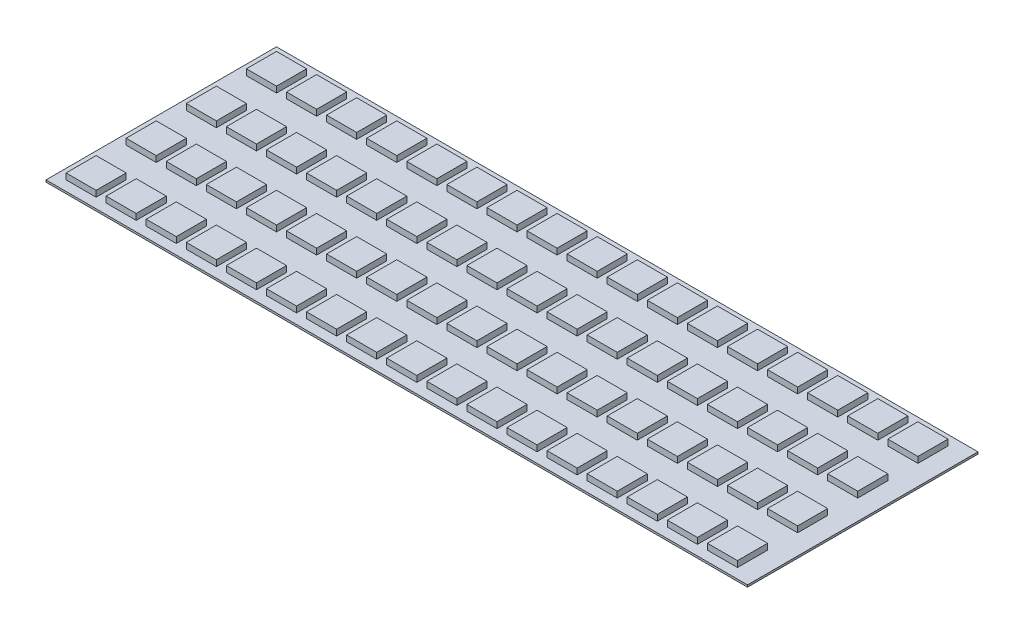
from build123d import *

# Parameters (mm, degrees)
SKETCH_1_W                        = 350
SKETCH_1_H                        = 115
EXTRUDE_1_DEPTH                   = 1
SKETCH_2_W                        = 15
SKETCH_2_H                        = 15
EXTRUDE_2_DEPTH                   = 3
PATTERN_LINEAR_1_COUNT            = 17
PATTERN_LINEAR_1_PITCH            = 20
PATTERN_LINEAR_2_COUNT            = 4
PATTERN_LINEAR_2_PITCH            = 30
PATTERN_LINEAR_2_COPY_1_SKETCH_W  = 15
PATTERN_LINEAR_2_COPY_1_SKETCH_H  = 15
PATTERN_LINEAR_2_COPY_1_DEPTH     = 3
PATTERN_LINEAR_2_COPY_2_SKETCH_W  = 15
PATTERN_LINEAR_2_COPY_2_SKETCH_H  = 15
PATTERN_LINEAR_2_COPY_2_DEPTH     = 3
PATTERN_LINEAR_2_COPY_3_SKETCH_W  = 15
PATTERN_LINEAR_2_COPY_3_SKETCH_H  = 15
PATTERN_LINEAR_2_COPY_3_DEPTH     = 3
PATTERN_LINEAR_2_COPY_4_SKETCH_W  = 15
PATTERN_LINEAR_2_COPY_4_SKETCH_H  = 15
PATTERN_LINEAR_2_COPY_4_DEPTH     = 3
PATTERN_LINEAR_2_COPY_5_SKETCH_W  = 15
PATTERN_LINEAR_2_COPY_5_SKETCH_H  = 15
PATTERN_LINEAR_2_COPY_5_DEPTH     = 3
PATTERN_LINEAR_2_COPY_6_SKETCH_W  = 15
PATTERN_LINEAR_2_COPY_6_SKETCH_H  = 15
PATTERN_LINEAR_2_COPY_6_DEPTH     = 3
PATTERN_LINEAR_2_COPY_7_SKETCH_W  = 15
PATTERN_LINEAR_2_COPY_7_SKETCH_H  = 15
PATTERN_LINEAR_2_COPY_7_DEPTH     = 3
PATTERN_LINEAR_2_COPY_8_SKETCH_W  = 15
PATTERN_LINEAR_2_COPY_8_SKETCH_H  = 15
PATTERN_LINEAR_2_COPY_8_DEPTH     = 3
PATTERN_LINEAR_2_COPY_9_SKETCH_W  = 15
PATTERN_LINEAR_2_COPY_9_SKETCH_H  = 15
PATTERN_LINEAR_2_COPY_9_DEPTH     = 3
PATTERN_LINEAR_2_COPY_10_SKETCH_W = 15
PATTERN_LINEAR_2_COPY_10_SKETCH_H = 15
PATTERN_LINEAR_2_COPY_10_DEPTH    = 3
PATTERN_LINEAR_2_COPY_11_SKETCH_W = 15
PATTERN_LINEAR_2_COPY_11_SKETCH_H = 15
PATTERN_LINEAR_2_COPY_11_DEPTH    = 3
PATTERN_LINEAR_2_COPY_12_SKETCH_W = 15
PATTERN_LINEAR_2_COPY_12_SKETCH_H = 15
PATTERN_LINEAR_2_COPY_12_DEPTH    = 3
PATTERN_LINEAR_2_COPY_13_SKETCH_W = 15
PATTERN_LINEAR_2_COPY_13_SKETCH_H = 15
PATTERN_LINEAR_2_COPY_13_DEPTH    = 3
PATTERN_LINEAR_2_COPY_14_SKETCH_W = 15
PATTERN_LINEAR_2_COPY_14_SKETCH_H = 15
PATTERN_LINEAR_2_COPY_14_DEPTH    = 3
PATTERN_LINEAR_2_COPY_15_SKETCH_W = 15
PATTERN_LINEAR_2_COPY_15_SKETCH_H = 15
PATTERN_LINEAR_2_COPY_15_DEPTH    = 3
PATTERN_LINEAR_2_COPY_16_SKETCH_W = 15
PATTERN_LINEAR_2_COPY_16_SKETCH_H = 15
PATTERN_LINEAR_2_COPY_16_DEPTH    = 3
PATTERN_LINEAR_2_COPY_17_SKETCH_W = 15
PATTERN_LINEAR_2_COPY_17_SKETCH_H = 15
PATTERN_LINEAR_2_COPY_17_DEPTH    = 3
PATTERN_LINEAR_2_COPY_18_SKETCH_W = 15
PATTERN_LINEAR_2_COPY_18_SKETCH_H = 15
PATTERN_LINEAR_2_COPY_18_DEPTH    = 3
PATTERN_LINEAR_2_COPY_19_SKETCH_W = 15
PATTERN_LINEAR_2_COPY_19_SKETCH_H = 15
PATTERN_LINEAR_2_COPY_19_DEPTH    = 3
PATTERN_LINEAR_2_COPY_20_SKETCH_W = 15
PATTERN_LINEAR_2_COPY_20_SKETCH_H = 15
PATTERN_LINEAR_2_COPY_20_DEPTH    = 3
PATTERN_LINEAR_2_COPY_21_SKETCH_W = 15
PATTERN_LINEAR_2_COPY_21_SKETCH_H = 15
PATTERN_LINEAR_2_COPY_21_DEPTH    = 3
PATTERN_LINEAR_2_COPY_22_SKETCH_W = 15
PATTERN_LINEAR_2_COPY_22_SKETCH_H = 15
PATTERN_LINEAR_2_COPY_22_DEPTH    = 3
PATTERN_LINEAR_2_COPY_23_SKETCH_W = 15
PATTERN_LINEAR_2_COPY_23_SKETCH_H = 15
PATTERN_LINEAR_2_COPY_23_DEPTH    = 3
PATTERN_LINEAR_2_COPY_24_SKETCH_W = 15
PATTERN_LINEAR_2_COPY_24_SKETCH_H = 15
PATTERN_LINEAR_2_COPY_24_DEPTH    = 3
PATTERN_LINEAR_2_COPY_25_SKETCH_W = 15
PATTERN_LINEAR_2_COPY_25_SKETCH_H = 15
PATTERN_LINEAR_2_COPY_25_DEPTH    = 3
PATTERN_LINEAR_2_COPY_26_SKETCH_W = 15
PATTERN_LINEAR_2_COPY_26_SKETCH_H = 15
PATTERN_LINEAR_2_COPY_26_DEPTH    = 3
PATTERN_LINEAR_2_COPY_27_SKETCH_W = 15
PATTERN_LINEAR_2_COPY_27_SKETCH_H = 15
PATTERN_LINEAR_2_COPY_27_DEPTH    = 3
PATTERN_LINEAR_2_COPY_28_SKETCH_W = 15
PATTERN_LINEAR_2_COPY_28_SKETCH_H = 15
PATTERN_LINEAR_2_COPY_28_DEPTH    = 3
PATTERN_LINEAR_2_COPY_29_SKETCH_W = 15
PATTERN_LINEAR_2_COPY_29_SKETCH_H = 15
PATTERN_LINEAR_2_COPY_29_DEPTH    = 3
PATTERN_LINEAR_2_COPY_30_SKETCH_W = 15
PATTERN_LINEAR_2_COPY_30_SKETCH_H = 15
PATTERN_LINEAR_2_COPY_30_DEPTH    = 3
PATTERN_LINEAR_2_COPY_31_SKETCH_W = 15
PATTERN_LINEAR_2_COPY_31_SKETCH_H = 15
PATTERN_LINEAR_2_COPY_31_DEPTH    = 3
PATTERN_LINEAR_2_COPY_32_SKETCH_W = 15
PATTERN_LINEAR_2_COPY_32_SKETCH_H = 15
PATTERN_LINEAR_2_COPY_32_DEPTH    = 3
PATTERN_LINEAR_2_COPY_33_SKETCH_W = 15
PATTERN_LINEAR_2_COPY_33_SKETCH_H = 15
PATTERN_LINEAR_2_COPY_33_DEPTH    = 3
PATTERN_LINEAR_2_COPY_34_SKETCH_W = 15
PATTERN_LINEAR_2_COPY_34_SKETCH_H = 15
PATTERN_LINEAR_2_COPY_34_DEPTH    = 3
PATTERN_LINEAR_2_COPY_35_SKETCH_W = 15
PATTERN_LINEAR_2_COPY_35_SKETCH_H = 15
PATTERN_LINEAR_2_COPY_35_DEPTH    = 3
PATTERN_LINEAR_2_COPY_36_SKETCH_W = 15
PATTERN_LINEAR_2_COPY_36_SKETCH_H = 15
PATTERN_LINEAR_2_COPY_36_DEPTH    = 3
PATTERN_LINEAR_2_COPY_37_SKETCH_W = 15
PATTERN_LINEAR_2_COPY_37_SKETCH_H = 15
PATTERN_LINEAR_2_COPY_37_DEPTH    = 3
PATTERN_LINEAR_2_COPY_38_SKETCH_W = 15
PATTERN_LINEAR_2_COPY_38_SKETCH_H = 15
PATTERN_LINEAR_2_COPY_38_DEPTH    = 3
PATTERN_LINEAR_2_COPY_39_SKETCH_W = 15
PATTERN_LINEAR_2_COPY_39_SKETCH_H = 15
PATTERN_LINEAR_2_COPY_39_DEPTH    = 3
PATTERN_LINEAR_2_COPY_40_SKETCH_W = 15
PATTERN_LINEAR_2_COPY_40_SKETCH_H = 15
PATTERN_LINEAR_2_COPY_40_DEPTH    = 3
PATTERN_LINEAR_2_COPY_41_SKETCH_W = 15
PATTERN_LINEAR_2_COPY_41_SKETCH_H = 15
PATTERN_LINEAR_2_COPY_41_DEPTH    = 3
PATTERN_LINEAR_2_COPY_42_SKETCH_W = 15
PATTERN_LINEAR_2_COPY_42_SKETCH_H = 15
PATTERN_LINEAR_2_COPY_42_DEPTH    = 3
PATTERN_LINEAR_2_COPY_43_SKETCH_W = 15
PATTERN_LINEAR_2_COPY_43_SKETCH_H = 15
PATTERN_LINEAR_2_COPY_43_DEPTH    = 3
PATTERN_LINEAR_2_COPY_44_SKETCH_W = 15
PATTERN_LINEAR_2_COPY_44_SKETCH_H = 15
PATTERN_LINEAR_2_COPY_44_DEPTH    = 3
PATTERN_LINEAR_2_COPY_45_SKETCH_W = 15
PATTERN_LINEAR_2_COPY_45_SKETCH_H = 15
PATTERN_LINEAR_2_COPY_45_DEPTH    = 3
PATTERN_LINEAR_2_COPY_46_SKETCH_W = 15
PATTERN_LINEAR_2_COPY_46_SKETCH_H = 15
PATTERN_LINEAR_2_COPY_46_DEPTH    = 3
PATTERN_LINEAR_2_COPY_47_SKETCH_W = 15
PATTERN_LINEAR_2_COPY_47_SKETCH_H = 15
PATTERN_LINEAR_2_COPY_47_DEPTH    = 3
PATTERN_LINEAR_2_COPY_48_SKETCH_W = 15
PATTERN_LINEAR_2_COPY_48_SKETCH_H = 15
PATTERN_LINEAR_2_COPY_48_DEPTH    = 3


with BuildPart() as part:
    # 草圖1 → 填料-伸長1 (new body)
    with BuildSketch(Plane(origin=(0, 0, 0), x_dir=(1, 0, 0), z_dir=(0, 1, 0))):
        with Locations((175, 57.5)):
            Rectangle(SKETCH_1_W, SKETCH_1_H)
    extrude(amount=EXTRUDE_1_DEPTH)

    # 草圖2 → 填料-伸長2 (add)
    with BuildSketch(Plane(origin=(0, 1, 0), x_dir=(1, 0, 0), z_dir=(0, 1, 0))):
        with Locations((12.5, 12.5)):
            Rectangle(SKETCH_2_W, SKETCH_2_H)
    extrude_2 = extrude(amount=EXTRUDE_2_DEPTH)

    # 直線複製排列1: 填料-伸長2 ×17
    with Locations(*[(i * PATTERN_LINEAR_1_PITCH, 0, 0) for i in range(1, PATTERN_LINEAR_1_COUNT)]):
        add(extrude_2)

    # 直線複製排列2: 填料-伸長2 ×4
    with Locations(*[(0, 0, -i * PATTERN_LINEAR_2_PITCH) for i in range(1, PATTERN_LINEAR_2_COUNT)]):
        add(extrude_2)

    # 直線複製排列2 copy 1 sketch → 直線複製排列2 copy 1 (add)
    with BuildSketch(Plane(origin=(20, 1, -30), x_dir=(1, 0, 0), z_dir=(0, 1, 0))):
        with Locations((12.5, 12.5)):
            Rectangle(PATTERN_LINEAR_2_COPY_1_SKETCH_W, PATTERN_LINEAR_2_COPY_1_SKETCH_H)
    extrude(amount=PATTERN_LINEAR_2_COPY_1_DEPTH)

    # 直線複製排列2 copy 2 sketch → 直線複製排列2 copy 2 (add)
    with BuildSketch(Plane(origin=(20, 1, -60), x_dir=(1, 0, 0), z_dir=(0, 1, 0))):
        with Locations((12.5, 12.5)):
            Rectangle(PATTERN_LINEAR_2_COPY_2_SKETCH_W, PATTERN_LINEAR_2_COPY_2_SKETCH_H)
    extrude(amount=PATTERN_LINEAR_2_COPY_2_DEPTH)

    # 直線複製排列2 copy 3 sketch → 直線複製排列2 copy 3 (add)
    with BuildSketch(Plane(origin=(20, 1, -90), x_dir=(1, 0, 0), z_dir=(0, 1, 0))):
        with Locations((12.5, 12.5)):
            Rectangle(PATTERN_LINEAR_2_COPY_3_SKETCH_W, PATTERN_LINEAR_2_COPY_3_SKETCH_H)
    extrude(amount=PATTERN_LINEAR_2_COPY_3_DEPTH)

    # 直線複製排列2 copy 4 sketch → 直線複製排列2 copy 4 (add)
    with BuildSketch(Plane(origin=(40, 1, -30), x_dir=(1, 0, 0), z_dir=(0, 1, 0))):
        with Locations((12.5, 12.5)):
            Rectangle(PATTERN_LINEAR_2_COPY_4_SKETCH_W, PATTERN_LINEAR_2_COPY_4_SKETCH_H)
    extrude(amount=PATTERN_LINEAR_2_COPY_4_DEPTH)

    # 直線複製排列2 copy 5 sketch → 直線複製排列2 copy 5 (add)
    with BuildSketch(Plane(origin=(40, 1, -60), x_dir=(1, 0, 0), z_dir=(0, 1, 0))):
        with Locations((12.5, 12.5)):
            Rectangle(PATTERN_LINEAR_2_COPY_5_SKETCH_W, PATTERN_LINEAR_2_COPY_5_SKETCH_H)
    extrude(amount=PATTERN_LINEAR_2_COPY_5_DEPTH)

    # 直線複製排列2 copy 6 sketch → 直線複製排列2 copy 6 (add)
    with BuildSketch(Plane(origin=(40, 1, -90), x_dir=(1, 0, 0), z_dir=(0, 1, 0))):
        with Locations((12.5, 12.5)):
            Rectangle(PATTERN_LINEAR_2_COPY_6_SKETCH_W, PATTERN_LINEAR_2_COPY_6_SKETCH_H)
    extrude(amount=PATTERN_LINEAR_2_COPY_6_DEPTH)

    # 直線複製排列2 copy 7 sketch → 直線複製排列2 copy 7 (add)
    with BuildSketch(Plane(origin=(60, 1, -30), x_dir=(1, 0, 0), z_dir=(0, 1, 0))):
        with Locations((12.5, 12.5)):
            Rectangle(PATTERN_LINEAR_2_COPY_7_SKETCH_W, PATTERN_LINEAR_2_COPY_7_SKETCH_H)
    extrude(amount=PATTERN_LINEAR_2_COPY_7_DEPTH)

    # 直線複製排列2 copy 8 sketch → 直線複製排列2 copy 8 (add)
    with BuildSketch(Plane(origin=(60, 1, -60), x_dir=(1, 0, 0), z_dir=(0, 1, 0))):
        with Locations((12.5, 12.5)):
            Rectangle(PATTERN_LINEAR_2_COPY_8_SKETCH_W, PATTERN_LINEAR_2_COPY_8_SKETCH_H)
    extrude(amount=PATTERN_LINEAR_2_COPY_8_DEPTH)

    # 直線複製排列2 copy 9 sketch → 直線複製排列2 copy 9 (add)
    with BuildSketch(Plane(origin=(60, 1, -90), x_dir=(1, 0, 0), z_dir=(0, 1, 0))):
        with Locations((12.5, 12.5)):
            Rectangle(PATTERN_LINEAR_2_COPY_9_SKETCH_W, PATTERN_LINEAR_2_COPY_9_SKETCH_H)
    extrude(amount=PATTERN_LINEAR_2_COPY_9_DEPTH)

    # 直線複製排列2 copy 10 sketch → 直線複製排列2 copy 10 (add)
    with BuildSketch(Plane(origin=(80, 1, -30), x_dir=(1, 0, 0), z_dir=(0, 1, 0))):
        with Locations((12.5, 12.5)):
            Rectangle(PATTERN_LINEAR_2_COPY_10_SKETCH_W, PATTERN_LINEAR_2_COPY_10_SKETCH_H)
    extrude(amount=PATTERN_LINEAR_2_COPY_10_DEPTH)

    # 直線複製排列2 copy 11 sketch → 直線複製排列2 copy 11 (add)
    with BuildSketch(Plane(origin=(80, 1, -60), x_dir=(1, 0, 0), z_dir=(0, 1, 0))):
        with Locations((12.5, 12.5)):
            Rectangle(PATTERN_LINEAR_2_COPY_11_SKETCH_W, PATTERN_LINEAR_2_COPY_11_SKETCH_H)
    extrude(amount=PATTERN_LINEAR_2_COPY_11_DEPTH)

    # 直線複製排列2 copy 12 sketch → 直線複製排列2 copy 12 (add)
    with BuildSketch(Plane(origin=(80, 1, -90), x_dir=(1, 0, 0), z_dir=(0, 1, 0))):
        with Locations((12.5, 12.5)):
            Rectangle(PATTERN_LINEAR_2_COPY_12_SKETCH_W, PATTERN_LINEAR_2_COPY_12_SKETCH_H)
    extrude(amount=PATTERN_LINEAR_2_COPY_12_DEPTH)

    # 直線複製排列2 copy 13 sketch → 直線複製排列2 copy 13 (add)
    with BuildSketch(Plane(origin=(100, 1, -30), x_dir=(1, 0, 0), z_dir=(0, 1, 0))):
        with Locations((12.5, 12.5)):
            Rectangle(PATTERN_LINEAR_2_COPY_13_SKETCH_W, PATTERN_LINEAR_2_COPY_13_SKETCH_H)
    extrude(amount=PATTERN_LINEAR_2_COPY_13_DEPTH)

    # 直線複製排列2 copy 14 sketch → 直線複製排列2 copy 14 (add)
    with BuildSketch(Plane(origin=(100, 1, -60), x_dir=(1, 0, 0), z_dir=(0, 1, 0))):
        with Locations((12.5, 12.5)):
            Rectangle(PATTERN_LINEAR_2_COPY_14_SKETCH_W, PATTERN_LINEAR_2_COPY_14_SKETCH_H)
    extrude(amount=PATTERN_LINEAR_2_COPY_14_DEPTH)

    # 直線複製排列2 copy 15 sketch → 直線複製排列2 copy 15 (add)
    with BuildSketch(Plane(origin=(100, 1, -90), x_dir=(1, 0, 0), z_dir=(0, 1, 0))):
        with Locations((12.5, 12.5)):
            Rectangle(PATTERN_LINEAR_2_COPY_15_SKETCH_W, PATTERN_LINEAR_2_COPY_15_SKETCH_H)
    extrude(amount=PATTERN_LINEAR_2_COPY_15_DEPTH)

    # 直線複製排列2 copy 16 sketch → 直線複製排列2 copy 16 (add)
    with BuildSketch(Plane(origin=(120, 1, -30), x_dir=(1, 0, 0), z_dir=(0, 1, 0))):
        with Locations((12.5, 12.5)):
            Rectangle(PATTERN_LINEAR_2_COPY_16_SKETCH_W, PATTERN_LINEAR_2_COPY_16_SKETCH_H)
    extrude(amount=PATTERN_LINEAR_2_COPY_16_DEPTH)

    # 直線複製排列2 copy 17 sketch → 直線複製排列2 copy 17 (add)
    with BuildSketch(Plane(origin=(120, 1, -60), x_dir=(1, 0, 0), z_dir=(0, 1, 0))):
        with Locations((12.5, 12.5)):
            Rectangle(PATTERN_LINEAR_2_COPY_17_SKETCH_W, PATTERN_LINEAR_2_COPY_17_SKETCH_H)
    extrude(amount=PATTERN_LINEAR_2_COPY_17_DEPTH)

    # 直線複製排列2 copy 18 sketch → 直線複製排列2 copy 18 (add)
    with BuildSketch(Plane(origin=(120, 1, -90), x_dir=(1, 0, 0), z_dir=(0, 1, 0))):
        with Locations((12.5, 12.5)):
            Rectangle(PATTERN_LINEAR_2_COPY_18_SKETCH_W, PATTERN_LINEAR_2_COPY_18_SKETCH_H)
    extrude(amount=PATTERN_LINEAR_2_COPY_18_DEPTH)

    # 直線複製排列2 copy 19 sketch → 直線複製排列2 copy 19 (add)
    with BuildSketch(Plane(origin=(140, 1, -30), x_dir=(1, 0, 0), z_dir=(0, 1, 0))):
        with Locations((12.5, 12.5)):
            Rectangle(PATTERN_LINEAR_2_COPY_19_SKETCH_W, PATTERN_LINEAR_2_COPY_19_SKETCH_H)
    extrude(amount=PATTERN_LINEAR_2_COPY_19_DEPTH)

    # 直線複製排列2 copy 20 sketch → 直線複製排列2 copy 20 (add)
    with BuildSketch(Plane(origin=(140, 1, -60), x_dir=(1, 0, 0), z_dir=(0, 1, 0))):
        with Locations((12.5, 12.5)):
            Rectangle(PATTERN_LINEAR_2_COPY_20_SKETCH_W, PATTERN_LINEAR_2_COPY_20_SKETCH_H)
    extrude(amount=PATTERN_LINEAR_2_COPY_20_DEPTH)

    # 直線複製排列2 copy 21 sketch → 直線複製排列2 copy 21 (add)
    with BuildSketch(Plane(origin=(140, 1, -90), x_dir=(1, 0, 0), z_dir=(0, 1, 0))):
        with Locations((12.5, 12.5)):
            Rectangle(PATTERN_LINEAR_2_COPY_21_SKETCH_W, PATTERN_LINEAR_2_COPY_21_SKETCH_H)
    extrude(amount=PATTERN_LINEAR_2_COPY_21_DEPTH)

    # 直線複製排列2 copy 22 sketch → 直線複製排列2 copy 22 (add)
    with BuildSketch(Plane(origin=(160, 1, -30), x_dir=(1, 0, 0), z_dir=(0, 1, 0))):
        with Locations((12.5, 12.5)):
            Rectangle(PATTERN_LINEAR_2_COPY_22_SKETCH_W, PATTERN_LINEAR_2_COPY_22_SKETCH_H)
    extrude(amount=PATTERN_LINEAR_2_COPY_22_DEPTH)

    # 直線複製排列2 copy 23 sketch → 直線複製排列2 copy 23 (add)
    with BuildSketch(Plane(origin=(160, 1, -60), x_dir=(1, 0, 0), z_dir=(0, 1, 0))):
        with Locations((12.5, 12.5)):
            Rectangle(PATTERN_LINEAR_2_COPY_23_SKETCH_W, PATTERN_LINEAR_2_COPY_23_SKETCH_H)
    extrude(amount=PATTERN_LINEAR_2_COPY_23_DEPTH)

    # 直線複製排列2 copy 24 sketch → 直線複製排列2 copy 24 (add)
    with BuildSketch(Plane(origin=(160, 1, -90), x_dir=(1, 0, 0), z_dir=(0, 1, 0))):
        with Locations((12.5, 12.5)):
            Rectangle(PATTERN_LINEAR_2_COPY_24_SKETCH_W, PATTERN_LINEAR_2_COPY_24_SKETCH_H)
    extrude(amount=PATTERN_LINEAR_2_COPY_24_DEPTH)

    # 直線複製排列2 copy 25 sketch → 直線複製排列2 copy 25 (add)
    with BuildSketch(Plane(origin=(180, 1, -30), x_dir=(1, 0, 0), z_dir=(0, 1, 0))):
        with Locations((12.5, 12.5)):
            Rectangle(PATTERN_LINEAR_2_COPY_25_SKETCH_W, PATTERN_LINEAR_2_COPY_25_SKETCH_H)
    extrude(amount=PATTERN_LINEAR_2_COPY_25_DEPTH)

    # 直線複製排列2 copy 26 sketch → 直線複製排列2 copy 26 (add)
    with BuildSketch(Plane(origin=(180, 1, -60), x_dir=(1, 0, 0), z_dir=(0, 1, 0))):
        with Locations((12.5, 12.5)):
            Rectangle(PATTERN_LINEAR_2_COPY_26_SKETCH_W, PATTERN_LINEAR_2_COPY_26_SKETCH_H)
    extrude(amount=PATTERN_LINEAR_2_COPY_26_DEPTH)

    # 直線複製排列2 copy 27 sketch → 直線複製排列2 copy 27 (add)
    with BuildSketch(Plane(origin=(180, 1, -90), x_dir=(1, 0, 0), z_dir=(0, 1, 0))):
        with Locations((12.5, 12.5)):
            Rectangle(PATTERN_LINEAR_2_COPY_27_SKETCH_W, PATTERN_LINEAR_2_COPY_27_SKETCH_H)
    extrude(amount=PATTERN_LINEAR_2_COPY_27_DEPTH)

    # 直線複製排列2 copy 28 sketch → 直線複製排列2 copy 28 (add)
    with BuildSketch(Plane(origin=(200, 1, -30), x_dir=(1, 0, 0), z_dir=(0, 1, 0))):
        with Locations((12.5, 12.5)):
            Rectangle(PATTERN_LINEAR_2_COPY_28_SKETCH_W, PATTERN_LINEAR_2_COPY_28_SKETCH_H)
    extrude(amount=PATTERN_LINEAR_2_COPY_28_DEPTH)

    # 直線複製排列2 copy 29 sketch → 直線複製排列2 copy 29 (add)
    with BuildSketch(Plane(origin=(200, 1, -60), x_dir=(1, 0, 0), z_dir=(0, 1, 0))):
        with Locations((12.5, 12.5)):
            Rectangle(PATTERN_LINEAR_2_COPY_29_SKETCH_W, PATTERN_LINEAR_2_COPY_29_SKETCH_H)
    extrude(amount=PATTERN_LINEAR_2_COPY_29_DEPTH)

    # 直線複製排列2 copy 30 sketch → 直線複製排列2 copy 30 (add)
    with BuildSketch(Plane(origin=(200, 1, -90), x_dir=(1, 0, 0), z_dir=(0, 1, 0))):
        with Locations((12.5, 12.5)):
            Rectangle(PATTERN_LINEAR_2_COPY_30_SKETCH_W, PATTERN_LINEAR_2_COPY_30_SKETCH_H)
    extrude(amount=PATTERN_LINEAR_2_COPY_30_DEPTH)

    # 直線複製排列2 copy 31 sketch → 直線複製排列2 copy 31 (add)
    with BuildSketch(Plane(origin=(220, 1, -30), x_dir=(1, 0, 0), z_dir=(0, 1, 0))):
        with Locations((12.5, 12.5)):
            Rectangle(PATTERN_LINEAR_2_COPY_31_SKETCH_W, PATTERN_LINEAR_2_COPY_31_SKETCH_H)
    extrude(amount=PATTERN_LINEAR_2_COPY_31_DEPTH)

    # 直線複製排列2 copy 32 sketch → 直線複製排列2 copy 32 (add)
    with BuildSketch(Plane(origin=(220, 1, -60), x_dir=(1, 0, 0), z_dir=(0, 1, 0))):
        with Locations((12.5, 12.5)):
            Rectangle(PATTERN_LINEAR_2_COPY_32_SKETCH_W, PATTERN_LINEAR_2_COPY_32_SKETCH_H)
    extrude(amount=PATTERN_LINEAR_2_COPY_32_DEPTH)

    # 直線複製排列2 copy 33 sketch → 直線複製排列2 copy 33 (add)
    with BuildSketch(Plane(origin=(220, 1, -90), x_dir=(1, 0, 0), z_dir=(0, 1, 0))):
        with Locations((12.5, 12.5)):
            Rectangle(PATTERN_LINEAR_2_COPY_33_SKETCH_W, PATTERN_LINEAR_2_COPY_33_SKETCH_H)
    extrude(amount=PATTERN_LINEAR_2_COPY_33_DEPTH)

    # 直線複製排列2 copy 34 sketch → 直線複製排列2 copy 34 (add)
    with BuildSketch(Plane(origin=(240, 1, -30), x_dir=(1, 0, 0), z_dir=(0, 1, 0))):
        with Locations((12.5, 12.5)):
            Rectangle(PATTERN_LINEAR_2_COPY_34_SKETCH_W, PATTERN_LINEAR_2_COPY_34_SKETCH_H)
    extrude(amount=PATTERN_LINEAR_2_COPY_34_DEPTH)

    # 直線複製排列2 copy 35 sketch → 直線複製排列2 copy 35 (add)
    with BuildSketch(Plane(origin=(240, 1, -60), x_dir=(1, 0, 0), z_dir=(0, 1, 0))):
        with Locations((12.5, 12.5)):
            Rectangle(PATTERN_LINEAR_2_COPY_35_SKETCH_W, PATTERN_LINEAR_2_COPY_35_SKETCH_H)
    extrude(amount=PATTERN_LINEAR_2_COPY_35_DEPTH)

    # 直線複製排列2 copy 36 sketch → 直線複製排列2 copy 36 (add)
    with BuildSketch(Plane(origin=(240, 1, -90), x_dir=(1, 0, 0), z_dir=(0, 1, 0))):
        with Locations((12.5, 12.5)):
            Rectangle(PATTERN_LINEAR_2_COPY_36_SKETCH_W, PATTERN_LINEAR_2_COPY_36_SKETCH_H)
    extrude(amount=PATTERN_LINEAR_2_COPY_36_DEPTH)

    # 直線複製排列2 copy 37 sketch → 直線複製排列2 copy 37 (add)
    with BuildSketch(Plane(origin=(260, 1, -30), x_dir=(1, 0, 0), z_dir=(0, 1, 0))):
        with Locations((12.5, 12.5)):
            Rectangle(PATTERN_LINEAR_2_COPY_37_SKETCH_W, PATTERN_LINEAR_2_COPY_37_SKETCH_H)
    extrude(amount=PATTERN_LINEAR_2_COPY_37_DEPTH)

    # 直線複製排列2 copy 38 sketch → 直線複製排列2 copy 38 (add)
    with BuildSketch(Plane(origin=(260, 1, -60), x_dir=(1, 0, 0), z_dir=(0, 1, 0))):
        with Locations((12.5, 12.5)):
            Rectangle(PATTERN_LINEAR_2_COPY_38_SKETCH_W, PATTERN_LINEAR_2_COPY_38_SKETCH_H)
    extrude(amount=PATTERN_LINEAR_2_COPY_38_DEPTH)

    # 直線複製排列2 copy 39 sketch → 直線複製排列2 copy 39 (add)
    with BuildSketch(Plane(origin=(260, 1, -90), x_dir=(1, 0, 0), z_dir=(0, 1, 0))):
        with Locations((12.5, 12.5)):
            Rectangle(PATTERN_LINEAR_2_COPY_39_SKETCH_W, PATTERN_LINEAR_2_COPY_39_SKETCH_H)
    extrude(amount=PATTERN_LINEAR_2_COPY_39_DEPTH)

    # 直線複製排列2 copy 40 sketch → 直線複製排列2 copy 40 (add)
    with BuildSketch(Plane(origin=(280, 1, -30), x_dir=(1, 0, 0), z_dir=(0, 1, 0))):
        with Locations((12.5, 12.5)):
            Rectangle(PATTERN_LINEAR_2_COPY_40_SKETCH_W, PATTERN_LINEAR_2_COPY_40_SKETCH_H)
    extrude(amount=PATTERN_LINEAR_2_COPY_40_DEPTH)

    # 直線複製排列2 copy 41 sketch → 直線複製排列2 copy 41 (add)
    with BuildSketch(Plane(origin=(280, 1, -60), x_dir=(1, 0, 0), z_dir=(0, 1, 0))):
        with Locations((12.5, 12.5)):
            Rectangle(PATTERN_LINEAR_2_COPY_41_SKETCH_W, PATTERN_LINEAR_2_COPY_41_SKETCH_H)
    extrude(amount=PATTERN_LINEAR_2_COPY_41_DEPTH)

    # 直線複製排列2 copy 42 sketch → 直線複製排列2 copy 42 (add)
    with BuildSketch(Plane(origin=(280, 1, -90), x_dir=(1, 0, 0), z_dir=(0, 1, 0))):
        with Locations((12.5, 12.5)):
            Rectangle(PATTERN_LINEAR_2_COPY_42_SKETCH_W, PATTERN_LINEAR_2_COPY_42_SKETCH_H)
    extrude(amount=PATTERN_LINEAR_2_COPY_42_DEPTH)

    # 直線複製排列2 copy 43 sketch → 直線複製排列2 copy 43 (add)
    with BuildSketch(Plane(origin=(300, 1, -30), x_dir=(1, 0, 0), z_dir=(0, 1, 0))):
        with Locations((12.5, 12.5)):
            Rectangle(PATTERN_LINEAR_2_COPY_43_SKETCH_W, PATTERN_LINEAR_2_COPY_43_SKETCH_H)
    extrude(amount=PATTERN_LINEAR_2_COPY_43_DEPTH)

    # 直線複製排列2 copy 44 sketch → 直線複製排列2 copy 44 (add)
    with BuildSketch(Plane(origin=(300, 1, -60), x_dir=(1, 0, 0), z_dir=(0, 1, 0))):
        with Locations((12.5, 12.5)):
            Rectangle(PATTERN_LINEAR_2_COPY_44_SKETCH_W, PATTERN_LINEAR_2_COPY_44_SKETCH_H)
    extrude(amount=PATTERN_LINEAR_2_COPY_44_DEPTH)

    # 直線複製排列2 copy 45 sketch → 直線複製排列2 copy 45 (add)
    with BuildSketch(Plane(origin=(300, 1, -90), x_dir=(1, 0, 0), z_dir=(0, 1, 0))):
        with Locations((12.5, 12.5)):
            Rectangle(PATTERN_LINEAR_2_COPY_45_SKETCH_W, PATTERN_LINEAR_2_COPY_45_SKETCH_H)
    extrude(amount=PATTERN_LINEAR_2_COPY_45_DEPTH)

    # 直線複製排列2 copy 46 sketch → 直線複製排列2 copy 46 (add)
    with BuildSketch(Plane(origin=(320, 1, -30), x_dir=(1, 0, 0), z_dir=(0, 1, 0))):
        with Locations((12.5, 12.5)):
            Rectangle(PATTERN_LINEAR_2_COPY_46_SKETCH_W, PATTERN_LINEAR_2_COPY_46_SKETCH_H)
    extrude(amount=PATTERN_LINEAR_2_COPY_46_DEPTH)

    # 直線複製排列2 copy 47 sketch → 直線複製排列2 copy 47 (add)
    with BuildSketch(Plane(origin=(320, 1, -60), x_dir=(1, 0, 0), z_dir=(0, 1, 0))):
        with Locations((12.5, 12.5)):
            Rectangle(PATTERN_LINEAR_2_COPY_47_SKETCH_W, PATTERN_LINEAR_2_COPY_47_SKETCH_H)
    extrude(amount=PATTERN_LINEAR_2_COPY_47_DEPTH)

    # 直線複製排列2 copy 48 sketch → 直線複製排列2 copy 48 (add)
    with BuildSketch(Plane(origin=(320, 1, -90), x_dir=(1, 0, 0), z_dir=(0, 1, 0))):
        with Locations((12.5, 12.5)):
            Rectangle(PATTERN_LINEAR_2_COPY_48_SKETCH_W, PATTERN_LINEAR_2_COPY_48_SKETCH_H)
    extrude(amount=PATTERN_LINEAR_2_COPY_48_DEPTH)


solid = part.part
